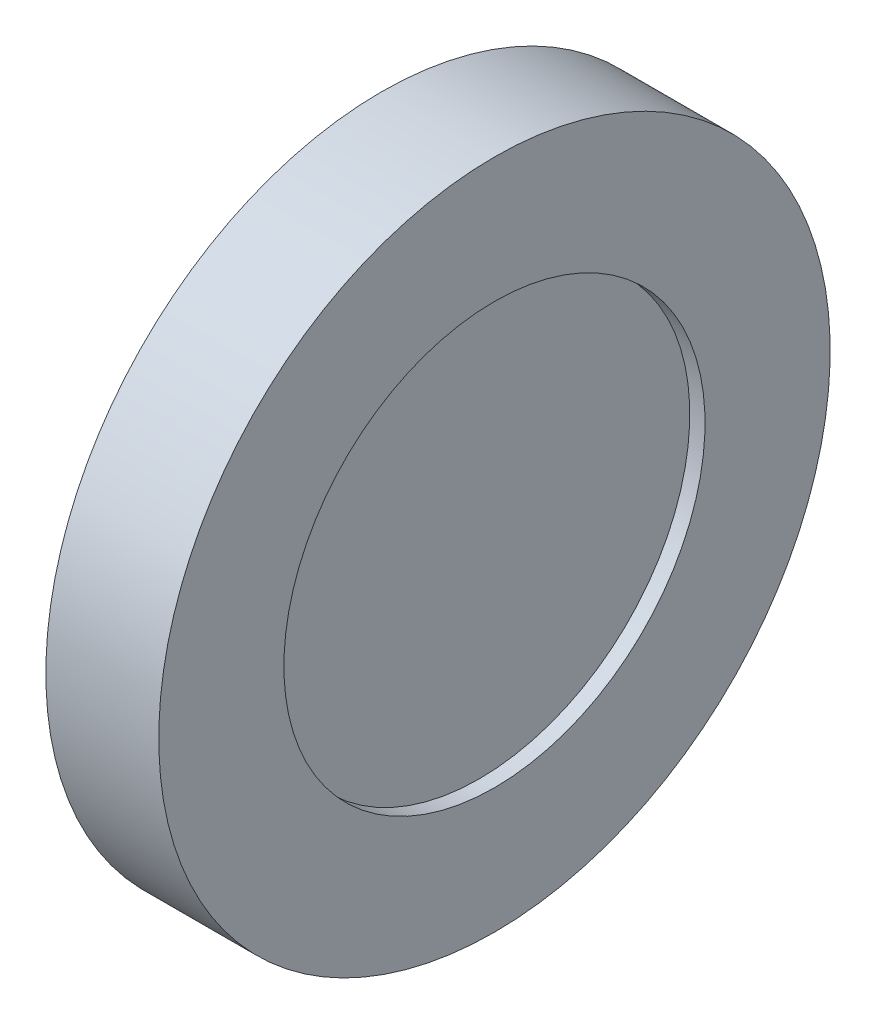
from build123d import *


with BuildPart() as part:
    # Sketch1 → Revolve1 (revolve)
    with BuildSketch(Plane.XY, mode=Mode.PRIVATE) as revolve1_sk:
        Polygon((-1.85, 11), (-1.85, 6.9), (-1.35, 6.9), (-1.35, 0), (1.35, 0), (1.35, 6.9), (1.85, 6.9), (1.85, 11), align=None)
    revolve(revolve1_sk.sketch.rotate(Axis((-1.85, 0, 0), (1, 0, 0)), 180), axis=Axis((-1.85, 0, 0), (1, 0, 0)))


solid = part.part
